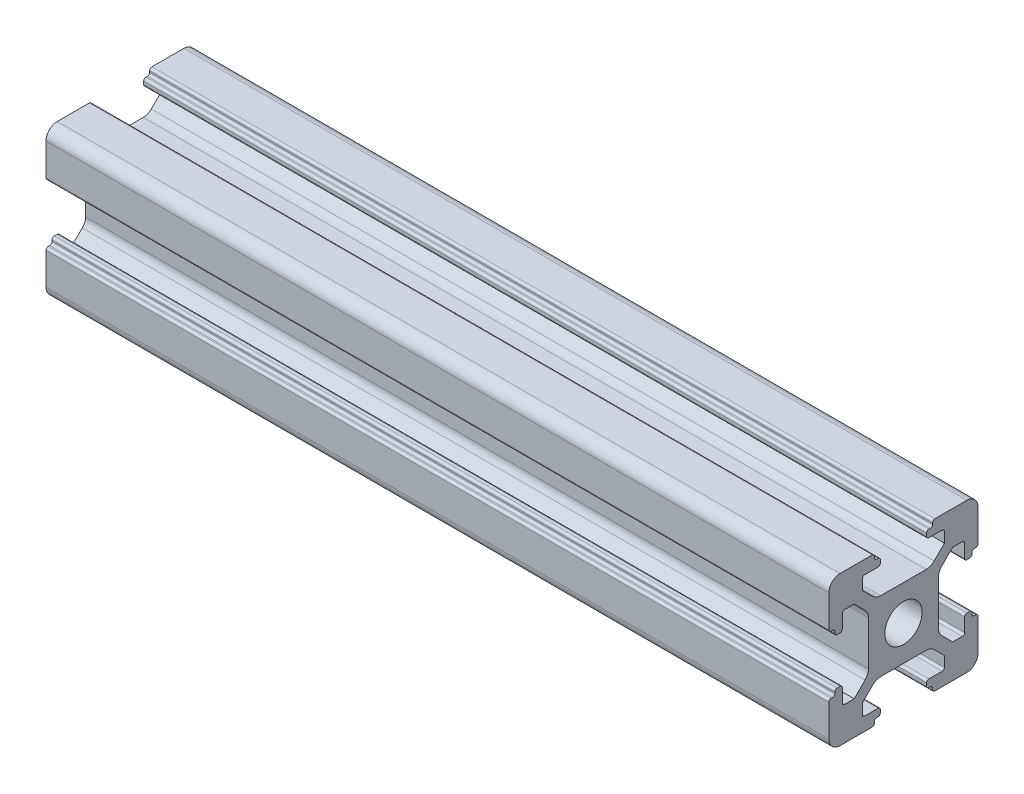
from build123d import *

# Parameters (mm, degrees)
SKETCH1_R           = 2.5
BOSS_EXTRUDE2_DEPTH = 52.5


with BuildPart() as part:
    # Sketch1 → Boss-Extrude2 (new, symmetric)
    with BuildSketch(Plane(origin=(0, 0, 0), x_dir=(0, 0, -1), z_dir=(1, 0, 0))):
        with BuildLine():
            Line((10, 4.2), (10, 8.5))
            ThreePointArc((10, 8.5), (9.560660172, 9.560660172), (8.5, 10))
            Line((8.5, 10), (4.2, 10))
            ThreePointArc((4.2, 10), (3.987867966, 9.912132034), (3.9, 9.7))
            Line((3.9, 9.7), (3.9, 9.5))
            ThreePointArc((3.9, 9.5), (3.812132034, 9.287867966), (3.6, 9.2))
            Line((3.6, 9.2), (3.4, 9.2))
            ThreePointArc((3.4, 9.2), (3.187867966, 9.112132034), (3.1, 8.9))
            Line((3.1, 8.9), (3.1, 8.5))
            ThreePointArc((3.1, 8.5), (3.187867966, 8.287867966), (3.4, 8.2))
            Line((3.4, 8.2), (5.2, 8.2))
            ThreePointArc((5.2, 8.2), (5.412132034, 8.112132034), (5.5, 7.9))
            Line((5.5, 7.9), (5.5, 6.521320344))
            Line((5.5, 6.521320344), (4.118019485, 5.139339828))
            ThreePointArc((4.118019485, 5.139339828), (3.631384461, 4.814180701), (3.057359313, 4.7))
            Line((3.057359313, 4.7), (-3.057359313, 4.7))
            ThreePointArc((-3.057359313, 4.7), (-3.631384461, 4.814180701), (-4.118019485, 5.139339828))
            Line((-4.118019485, 5.139339828), (-5.5, 6.521320344))
            Line((-5.5, 6.521320344), (-5.5, 7.9))
            ThreePointArc((-5.5, 7.9), (-5.412132034, 8.112132034), (-5.2, 8.2))
            Line((-5.2, 8.2), (-3.4, 8.2))
            ThreePointArc((-3.4, 8.2), (-3.187867966, 8.287867966), (-3.1, 8.5))
            Line((-3.1, 8.5), (-3.1, 8.9))
            ThreePointArc((-3.1, 8.9), (-3.187867966, 9.112132034), (-3.4, 9.2))
            Line((-3.4, 9.2), (-3.6, 9.2))
            ThreePointArc((-3.6, 9.2), (-3.812132034, 9.287867966), (-3.9, 9.5))
            Line((-3.9, 9.5), (-3.9, 9.7))
            ThreePointArc((-3.9, 9.7), (-3.987867966, 9.912132034), (-4.2, 10))
            Line((-4.2, 10), (-8.5, 10))
            ThreePointArc((-8.5, 10), (-9.560660172, 9.560660172), (-10, 8.5))
            Line((-10, 8.5), (-10, 4.2))
            ThreePointArc((-10, 4.2), (-9.912132034, 3.987867966), (-9.7, 3.9))
            Line((-9.7, 3.9), (-9.5, 3.9))
            ThreePointArc((-9.5, 3.9), (-9.287867966, 3.812132034), (-9.2, 3.6))
            Line((-9.2, 3.6), (-9.2, 3.4))
            ThreePointArc((-9.2, 3.4), (-9.112132034, 3.187867966), (-8.9, 3.1))
            Line((-8.9, 3.1), (-8.5, 3.1))
            ThreePointArc((-8.5, 3.1), (-8.287867966, 3.187867966), (-8.2, 3.4))
            Line((-8.2, 3.4), (-8.2, 5.2))
            ThreePointArc((-8.2, 5.2), (-8.112132034, 5.412132034), (-7.9, 5.5))
            Line((-7.9, 5.5), (-6.6, 5.5))
            Line((-6.6, 5.5), (-5.139339828, 4.039339828))
            ThreePointArc((-5.139339828, 4.039339828), (-4.814180701, 3.552704805), (-4.7, 2.978679656))
            Line((-4.7, 2.978679656), (-4.7, -2.978679656))
            ThreePointArc((-4.7, -2.978679656), (-4.814180701, -3.552704805), (-5.139339828, -4.039339828))
            Line((-5.139339828, -4.039339828), (-6.6, -5.5))
            Line((-6.6, -5.5), (-7.9, -5.5))
            ThreePointArc((-7.9, -5.5), (-8.112132034, -5.412132034), (-8.2, -5.2))
            Line((-8.2, -5.2), (-8.2, -3.4))
            ThreePointArc((-8.2, -3.4), (-8.287867966, -3.187867966), (-8.5, -3.1))
            Line((-8.5, -3.1), (-8.9, -3.1))
            ThreePointArc((-8.9, -3.1), (-9.112132034, -3.187867966), (-9.2, -3.4))
            Line((-9.2, -3.4), (-9.2, -3.6))
            ThreePointArc((-9.2, -3.6), (-9.287867966, -3.812132034), (-9.5, -3.9))
            Line((-9.5, -3.9), (-9.7, -3.9))
            ThreePointArc((-9.7, -3.9), (-9.912132034, -3.987867966), (-10, -4.2))
            Line((-10, -4.2), (-10, -8.5))
            ThreePointArc((-10, -8.5), (-9.560660172, -9.560660172), (-8.5, -10))
            Line((-8.5, -10), (-4.2, -10))
            ThreePointArc((-4.2, -10), (-3.987867966, -9.912132034), (-3.9, -9.7))
            Line((-3.9, -9.7), (-3.9, -9.5))
            ThreePointArc((-3.9, -9.5), (-3.812132034, -9.287867966), (-3.6, -9.2))
            Line((-3.6, -9.2), (-3.4, -9.2))
            ThreePointArc((-3.4, -9.2), (-3.187867966, -9.112132034), (-3.1, -8.9))
            Line((-3.1, -8.9), (-3.1, -8.5))
            ThreePointArc((-3.1, -8.5), (-3.187867966, -8.287867966), (-3.4, -8.2))
            Line((-3.4, -8.2), (-5.2, -8.2))
            ThreePointArc((-5.2, -8.2), (-5.412132034, -8.112132034), (-5.5, -7.9))
            Line((-5.5, -7.9), (-5.5, -6.521320344))
            Line((-5.5, -6.521320344), (-4.118019485, -5.139339828))
            ThreePointArc((-4.118019485, -5.139339828), (-3.631384461, -4.814180701), (-3.057359313, -4.7))
            Line((-3.057359313, -4.7), (3.057359313, -4.7))
            ThreePointArc((3.057359313, -4.7), (3.631384461, -4.814180701), (4.118019485, -5.139339828))
            Line((4.118019485, -5.139339828), (5.5, -6.521320344))
            Line((5.5, -6.521320344), (5.5, -7.9))
            ThreePointArc((5.5, -7.9), (5.412132034, -8.112132034), (5.2, -8.2))
            Line((5.2, -8.2), (3.4, -8.2))
            ThreePointArc((3.4, -8.2), (3.187867966, -8.287867966), (3.1, -8.5))
            Line((3.1, -8.5), (3.1, -8.9))
            ThreePointArc((3.1, -8.9), (3.187867966, -9.112132034), (3.4, -9.2))
            Line((3.4, -9.2), (3.6, -9.2))
            ThreePointArc((3.6, -9.2), (3.812132034, -9.287867966), (3.9, -9.5))
            Line((3.9, -9.5), (3.9, -9.7))
            ThreePointArc((3.9, -9.7), (3.987867966, -9.912132034), (4.2, -10))
            Line((4.2, -10), (8.5, -10))
            ThreePointArc((8.5, -10), (9.560660172, -9.560660172), (10, -8.5))
            Line((10, -8.5), (10, -4.2))
            ThreePointArc((10, -4.2), (9.912132034, -3.987867966), (9.7, -3.9))
            Line((9.7, -3.9), (9.5, -3.9))
            ThreePointArc((9.5, -3.9), (9.287867966, -3.812132034), (9.2, -3.6))
            Line((9.2, -3.6), (9.2, -3.4))
            ThreePointArc((9.2, -3.4), (9.112132034, -3.187867966), (8.9, -3.1))
            Line((8.9, -3.1), (8.5, -3.1))
            ThreePointArc((8.5, -3.1), (8.287867966, -3.187867966), (8.2, -3.4))
            Line((8.2, -3.4), (8.2, -5.2))
            ThreePointArc((8.2, -5.2), (8.112132034, -5.412132034), (7.9, -5.5))
            Line((7.9, -5.5), (6.6, -5.5))
            Line((6.6, -5.5), (5.139339828, -4.039339828))
            ThreePointArc((5.139339828, -4.039339828), (4.814180701, -3.552704805), (4.7, -2.978679656))
            Line((4.7, -2.978679656), (4.7, 2.978679656))
            ThreePointArc((4.7, 2.978679656), (4.814180701, 3.552704805), (5.139339828, 4.039339828))
            Line((5.139339828, 4.039339828), (6.6, 5.5))
            Line((6.6, 5.5), (7.9, 5.5))
            ThreePointArc((7.9, 5.5), (8.112132034, 5.412132034), (8.2, 5.2))
            Line((8.2, 5.2), (8.2, 3.4))
            ThreePointArc((8.2, 3.4), (8.287867966, 3.187867966), (8.5, 3.1))
            Line((8.5, 3.1), (8.9, 3.1))
            ThreePointArc((8.9, 3.1), (9.112132034, 3.187867966), (9.2, 3.4))
            Line((9.2, 3.4), (9.2, 3.6))
            ThreePointArc((9.2, 3.6), (9.287867966, 3.812132034), (9.5, 3.9))
            Line((9.5, 3.9), (9.7, 3.9))
            ThreePointArc((9.7, 3.9), (9.912132034, 3.987867966), (10, 4.2))
        make_face()
        Circle(SKETCH1_R, mode=Mode.SUBTRACT)
    extrude(amount=BOSS_EXTRUDE2_DEPTH, both=True)


solid = part.part
